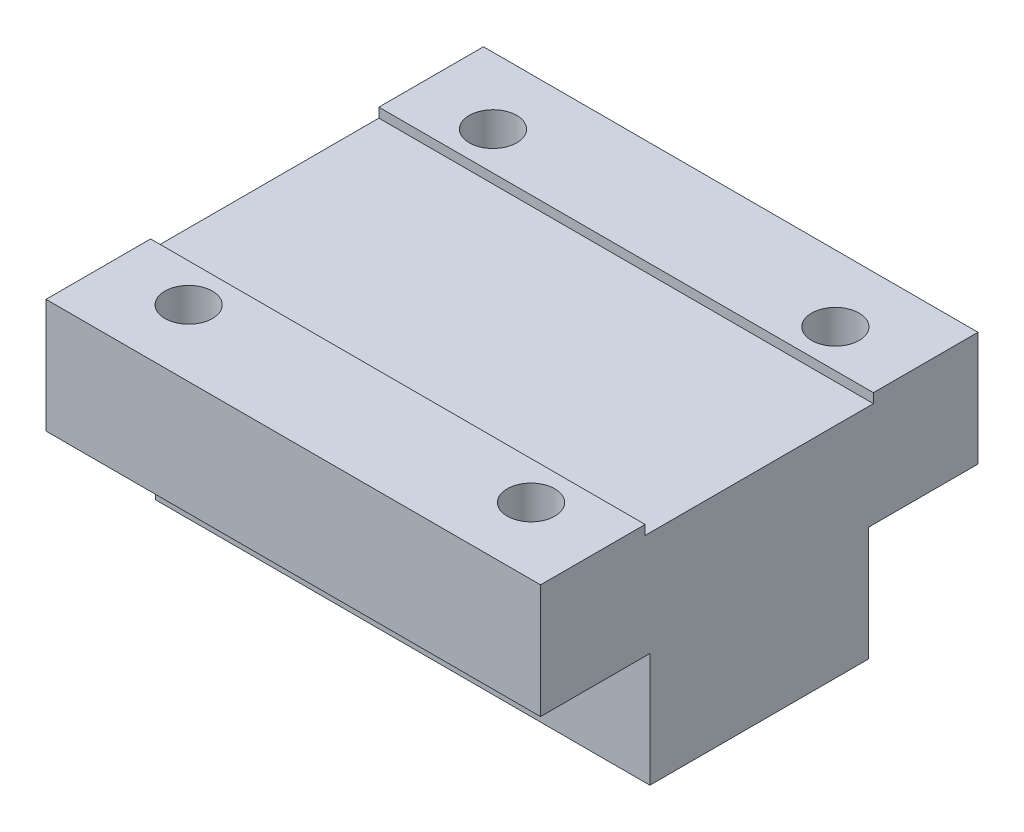
from build123d import *

# Parameters (mm, degrees)
SKETCH_1_W          = 52
SKETCH_1_H          = 46
EXTRUDE_1_DEPTH     = 12
SKETCH_2_W          = 52
SKETCH_2_H          = 23
EXTRUDE_2_DEPTH     = 12
SKETCH_3_R          = 2.5
CUT_EXTRUDE_1_DEPTH = 74.457470689
SKETCH_4_W          = 24
SKETCH_4_H          = 1
CUT_EXTRUDE_2_DEPTH = 71.455659815


with BuildPart() as part:
    # 草图1 → 凸台-拉伸1 (new body)
    with BuildSketch(Plane(origin=(0, 0, 0), x_dir=(1, 0, 0), z_dir=(0, 1, 0))):
        with Locations((26, 23)):
            Rectangle(SKETCH_1_W, SKETCH_1_H)
    extrude(amount=EXTRUDE_1_DEPTH)

    # 草图2 → 凸台-拉伸2 (add)
    with BuildSketch(Plane.XZ):
        with Locations((26, -23)):
            Rectangle(SKETCH_2_W, SKETCH_2_H)
    extrude(amount=EXTRUDE_2_DEPTH)

    # 草图3 → 切除-拉伸1 (cut, through all)
    with BuildSketch(Plane(origin=(0, 12, 0), x_dir=(1, 0, 0), z_dir=(0, 1, 0))):
        with Locations(Location((8, 39, 0), (0, 0, 270))):
            Circle(SKETCH_3_R)
        with Locations(Location((8, 7, 0), (0, 0, 90))):
            Circle(SKETCH_3_R)
        with Locations(Location((44, 7, 0), (0, 0, 270))):
            Circle(SKETCH_3_R)
        with Locations(Location((44, 39, 0), (0, 0, 90))):
            Circle(SKETCH_3_R)
    extrude(amount=-CUT_EXTRUDE_1_DEPTH, mode=Mode.SUBTRACT)

    # 草图4 → 切除-拉伸2 (cut, through all)
    with BuildSketch(Plane.ZY):
        with Locations((-23, 11.5)):
            Rectangle(SKETCH_4_W, SKETCH_4_H)
    extrude(amount=-CUT_EXTRUDE_2_DEPTH, mode=Mode.SUBTRACT)


solid = part.part
